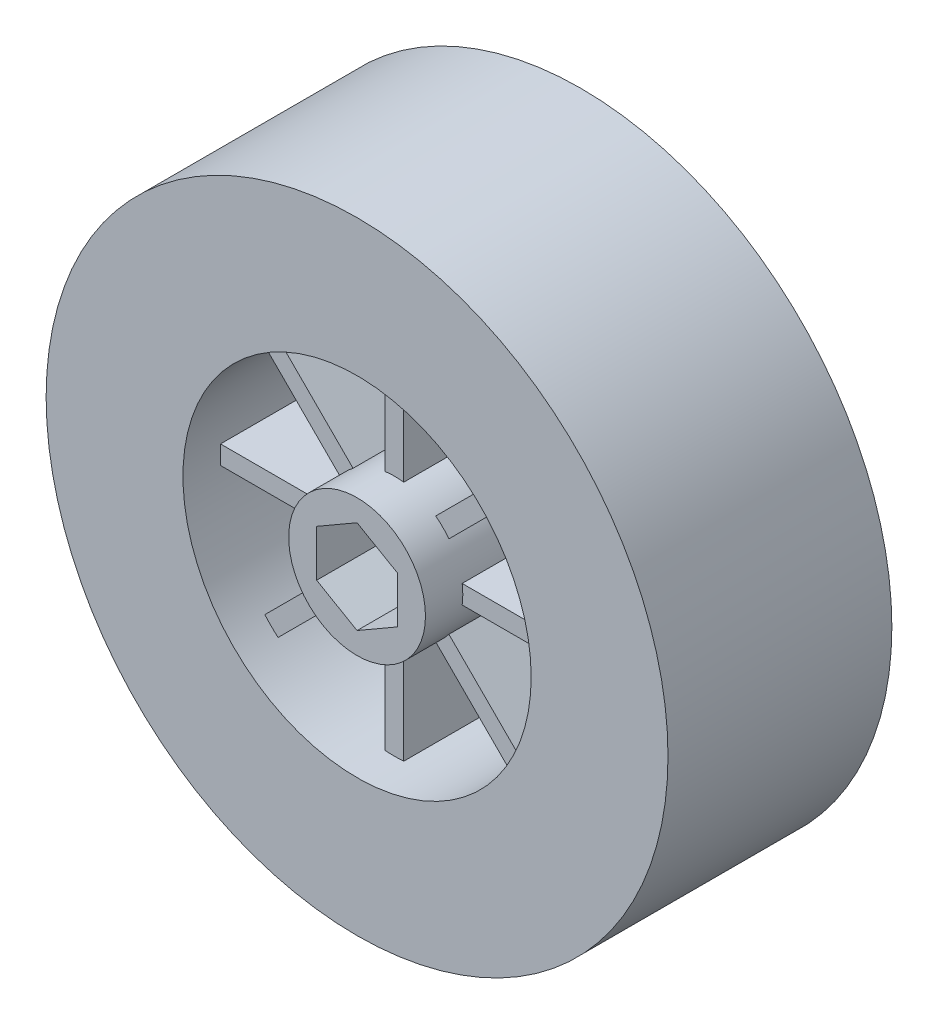
from build123d import *
from build123d.topology import SkipClean

# Parameters (mm, degrees)
SKETCH_2_R               = 25
EXTRUDE_1_DEPTH          = 9
SKETCH_3_R               = 14
SKETCH_3_R_2             = 5.5
CUT_EXTRUDE_1_DEPTH      = 3
CUT_EXTRUDE_3_DEPTH      = 13
SKETCH_6_R               = 2
CUT_EXTRUDE_4_DEPTH      = 5
CUT_EXTRUDE_5_DEPTH      = 20
PATTERN_CIRCULAR_1_COUNT = 8
SKETCH_8_R               = 5.5
CUT_EXTRUDE_6_DEPTH      = 3


with BuildPart() as part:
    # 草图2 → 凸台-拉伸1 (new, symmetric)
    with BuildSketch(Plane.XY):
        Circle(SKETCH_2_R)
    extrude(amount=EXTRUDE_1_DEPTH, both=True)

    # 草图3 → 切除-拉伸1 (cut)
    with BuildSketch(Plane.XY.offset(9)):
        Circle(SKETCH_3_R)
        Circle(SKETCH_3_R_2, mode=Mode.SUBTRACT)
    cut_extrude_1 = extrude(amount=-CUT_EXTRUDE_1_DEPTH, mode=Mode.SUBTRACT)

    # 镜向1: 切除-拉伸1 across plane
    add(cut_extrude_1.mirror(Plane.XY), mode=Mode.SUBTRACT)

    # 草图5 → 切除-拉伸3 (cut)
    with BuildSketch(Plane.XY.offset(9)):
        Polygon((3.25, -1.876388375), (3.25, 1.876388375), (0, 3.75277675), (-3.25, 1.876388375), (-3.25, -1.876388375), (0, -3.75277675), align=None)
    extrude(amount=-CUT_EXTRUDE_3_DEPTH, mode=Mode.SUBTRACT)

    # 草图6 → 切除-拉伸4 (cut)
    with BuildSketch(Plane(origin=(0, 0, -9), x_dir=(-1, 0, 0), z_dir=(0, 0, -1))):
        Circle(SKETCH_6_R)
    extrude(amount=-CUT_EXTRUDE_4_DEPTH, mode=Mode.SUBTRACT)

    # 草图7 → 切除-拉伸5 (cut)
    with BuildSketch(Plane(origin=(0, 0, -6), x_dir=(-1, 0, 0), z_dir=(0, 0, -1))):
        with BuildLine():
            Line((0.750176034, 13.979886835), (0.750176034, 5.448599446))
            ThreePointArc((0.750176034, 5.448599446), (2.104758878, 5.081337429), (3.322287055, 4.383196177))
            Line((3.322287055, 4.383196177), (9.35481822, 10.415727342))
            ThreePointArc((9.35481822, 10.415727342), (5.357568053, 12.934313455), (0.750176034, 13.979886835))
        make_face()
    cut_extrude_5 = extrude(amount=-CUT_EXTRUDE_5_DEPTH, mode=Mode.SUBTRACT)

    # 阵列(圆周)1: 切除-拉伸5 ×8 about axis
    with SkipClean():  # the faces are left unmerged after this step: merging them gives an invalid solid
        pattern_circular_1_axis = Axis((0, 0, 0), (0, 0, 1))
        for i in range(1, PATTERN_CIRCULAR_1_COUNT):
            add(cut_extrude_5.rotate(pattern_circular_1_axis, i * 360 / PATTERN_CIRCULAR_1_COUNT), mode=Mode.SUBTRACT)

    # 草图8 → 切除-拉伸6 (cut)
    with SkipClean():  # the faces are left unmerged after this step: merging them gives an invalid solid
        with BuildSketch(Plane(origin=(0, 0, -9), x_dir=(-1, 0, 0), z_dir=(0, 0, -1))):
            with Locations(Location((0, 0, 0), (0, 0, 180))):
                Circle(SKETCH_8_R)
        extrude(amount=-CUT_EXTRUDE_6_DEPTH, mode=Mode.SUBTRACT)


solid = part.part
